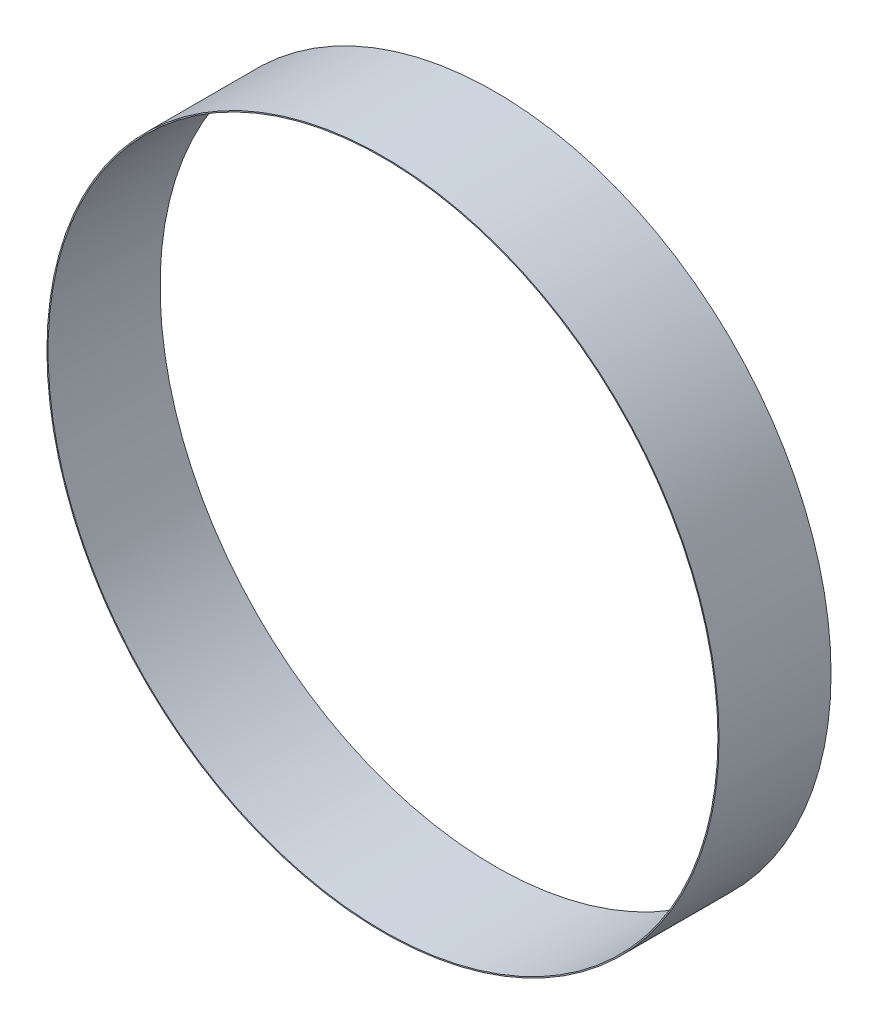
from build123d import *

# Parameters (mm, degrees)
SKETCH_1_R      = 1500
SKETCH_1_R_2    = 1495
EXTRUDE_1_DEPTH = 500


with BuildPart() as part:
    # Эскиз1 → Бобышка-Вытянуть1 (new body)
    with BuildSketch(Plane.XY):
        Circle(SKETCH_1_R)
        Circle(SKETCH_1_R_2, mode=Mode.SUBTRACT)
    extrude(amount=EXTRUDE_1_DEPTH)


solid = part.part
